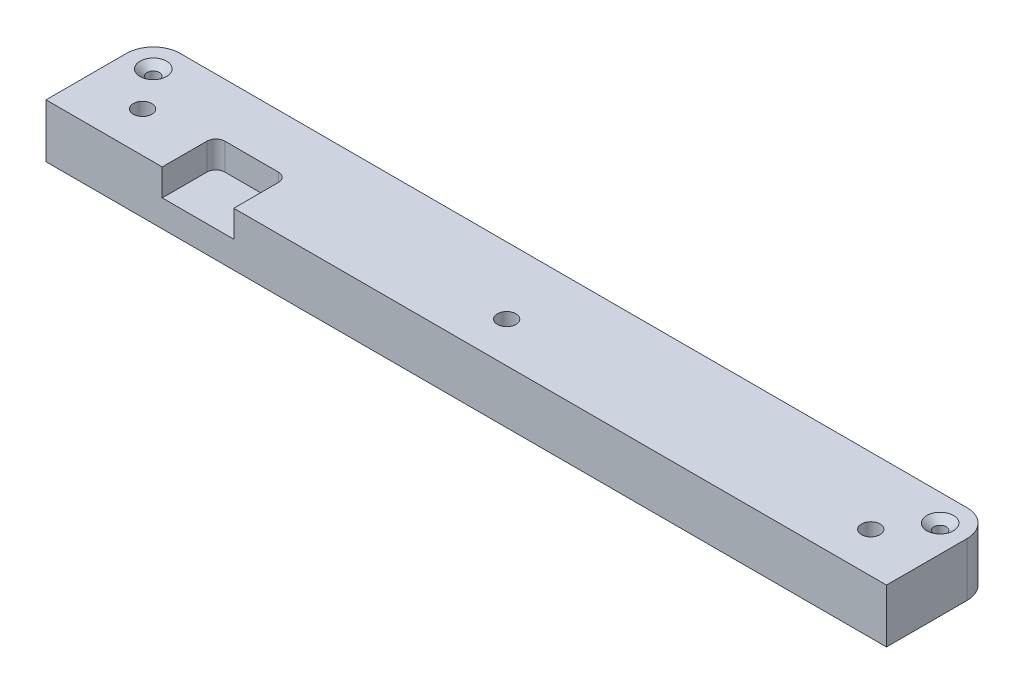
from build123d import *

# Parameters (mm, degrees)
SKETCH1_W           = 298.45
SKETCH1_H           = 38.1
BOSS_EXTRUDE1_DEPTH = 19.05
FILLET1_R           = 9.525
SKETCH2_R           = 3.302
CUT_EXTRUDE1_DEPTH  = 14.2875
SKETCH4_R           = 1.4224
CUT_EXTRUDE2_DEPTH  = 302.47456775
SKETCH5_R           = 2.413
CUT_EXTRUDE3_DEPTH  = 2.921
SKETCH6_R           = 2.1844
CUT_EXTRUDE4_DEPTH  = 302.47456775
CHAMFER1_SIZE       = 2.54
CHAMFER1_SIZE2      = 2.207988314
CUT_EXTRUDE5_START  = -5.08
SKETCH7_R           = 7.239
CUT_EXTRUDE5_DEPTH  = 297.39456775
CUT_EXTRUDE6_START  = -9.525
SKETCH8_W           = 25.4
SKETCH8_H           = 19.05
CUT_EXTRUDE6_DEPTH  = 9.525
FILLET2_R           = 3.175


with BuildPart() as part:
    # Sketch1 → Boss-Extrude1 (new body)
    with BuildSketch(Plane(origin=(0, 0, 0), x_dir=(1, 0, 0), z_dir=(0, 1, 0))):
        with Locations((149.225, 19.05)):
            Rectangle(SKETCH1_W, SKETCH1_H)
    extrude(amount=BOSS_EXTRUDE1_DEPTH)

    # Fillet1
    fillet1_edges = [part.edges().sort_by_distance(p)[0] for p in [
        (0, 9.525, -38.1),
        (298.45, 9.525, -38.1),
    ]]
    fillet(fillet1_edges, radius=FILLET1_R)

    # Sketch2 → Cut-Extrude1 (cut)
    with BuildSketch(Plane(origin=(0, 19.05, 0), x_dir=(1, 0, 0), z_dir=(0, 1, 0))):
        with Locations(Location((19.939, 14.351, 0), (0, 0, 270))):
            Circle(SKETCH2_R)
        with Locations(Location((149.225, 14.351, 0), (0, 0, 270))):
            Circle(SKETCH2_R)
        with Locations(Location((278.511, 14.351, 0), (0, 0, 270))):
            Circle(SKETCH2_R)
    extrude(amount=-CUT_EXTRUDE1_DEPTH, mode=Mode.SUBTRACT)

    # Sketch4 → Cut-Extrude2 (cut, through all)
    with BuildSketch(Plane.XZ):
        with Locations(Location((19.939, -14.351, 0), (0, 0, 270))):
            Circle(SKETCH4_R)
        with Locations(Location((149.225, -14.351, 0), (0, 0, 270))):
            Circle(SKETCH4_R)
        with Locations(Location((278.511, -14.351, 0), (0, 0, 270))):
            Circle(SKETCH4_R)
    extrude(amount=-CUT_EXTRUDE2_DEPTH, mode=Mode.SUBTRACT)

    # Sketch5 → Cut-Extrude3 (cut)
    with BuildSketch(Plane.XZ):
        with Locations(Location((19.939, -14.351, 0), (0, 0, 270))):
            Circle(SKETCH5_R)
        with Locations(Location((149.225, -14.351, 0), (0, 0, 270))):
            Circle(SKETCH5_R)
        with Locations(Location((278.511, -14.351, 0), (0, 0, 270))):
            Circle(SKETCH5_R)
    extrude(amount=-CUT_EXTRUDE3_DEPTH, mode=Mode.SUBTRACT)

    # Sketch6 → Cut-Extrude4 (cut, through all)
    with BuildSketch(Plane(origin=(0, 19.05, 0), x_dir=(1, 0, 0), z_dir=(0, 1, 0))):
        with BuildLine():
            ThreePointArc((286.7406, 28.575), (288.925, 26.3906), (291.1094, 28.575))
            Line((291.1094, 28.575), (286.7406, 28.575))
        make_face()
        with BuildLine():
            Line((286.7406, 28.575), (291.1094, 28.575))
            ThreePointArc((291.1094, 28.575), (288.925, 30.7594), (286.7406, 28.575))
        make_face()
        with Locations(Location((9.525, 28.575, 0), (0, 0, 270))):
            Circle(SKETCH6_R)
    extrude(amount=-CUT_EXTRUDE4_DEPTH, mode=Mode.SUBTRACT)

    # Chamfer1
    chamfer1_edges = [part.edges().sort_by_distance(p)[0] for p in [
        (291.1094, 19.05, -28.575),
        (9.525, 19.05, -30.7594),
    ]]
    chamfer1_side = [part.faces().sort_by_distance(p)[0] for p in [
        (149.225, 19.05, -19.008778326),
    ]]
    chamfer(chamfer1_edges, length=CHAMFER1_SIZE, length2=CHAMFER1_SIZE2, reference=chamfer1_side[0])

    # Sketch7 → Cut-Extrude5 (cut, through all)
    with BuildSketch(Plane(origin=(0, 19.05, 0), x_dir=(1, 0, 0), z_dir=(0, 1, 0)).offset(CUT_EXTRUDE5_START)):
        with Locations(Location((149.225, 28.575, 0), (0, 0, 270))):
            Circle(SKETCH7_R)
    extrude(amount=-CUT_EXTRUDE5_DEPTH, mode=Mode.SUBTRACT)

    # Sketch8 → Cut-Extrude6 (cut)
    with BuildSketch(Plane.XZ.offset(CUT_EXTRUDE6_START)):
        with Locations((53.975, -9.525)):
            Rectangle(SKETCH8_W, SKETCH8_H)
    extrude(amount=-CUT_EXTRUDE6_DEPTH, mode=Mode.SUBTRACT)

    # Fillet2
    fillet2_edges = [part.edges().sort_by_distance(p)[0] for p in [
        (41.275, 14.2875, -19.05),
        (66.675, 14.2875, -19.05),
    ]]
    fillet(fillet2_edges, radius=FILLET2_R)


solid = part.part
